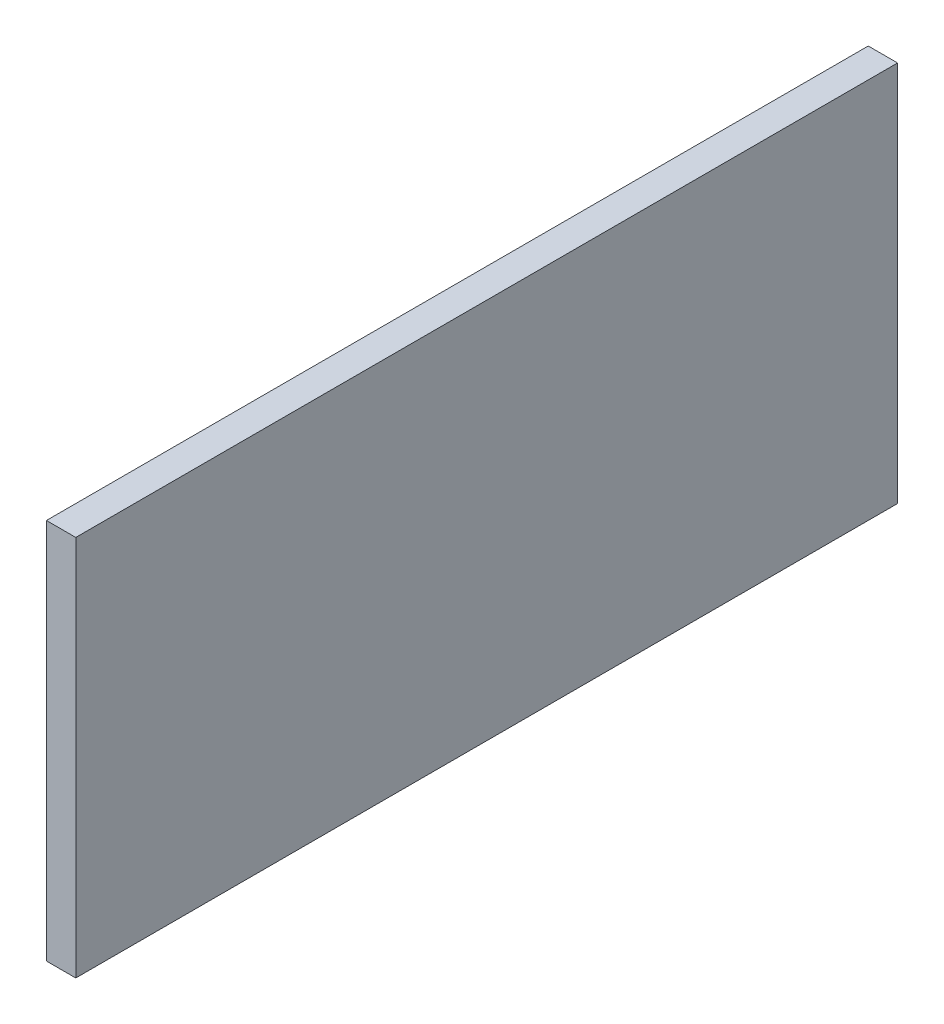
from build123d import *

# Parameters (mm, degrees)
SKETCH1_W           = 168
SKETCH1_H           = 78
BOSS_EXTRUDE1_DEPTH = 6


with BuildPart() as part:
    # Sketch1 → Boss-Extrude1 (new body)
    with BuildSketch(Plane(origin=(0, 0, 0), x_dir=(0, 0, -1), z_dir=(1, 0, 0))):
        with Locations((15.269584305, -31.396949486)):
            Rectangle(SKETCH1_W, SKETCH1_H)
    extrude(amount=BOSS_EXTRUDE1_DEPTH)


solid = part.part
